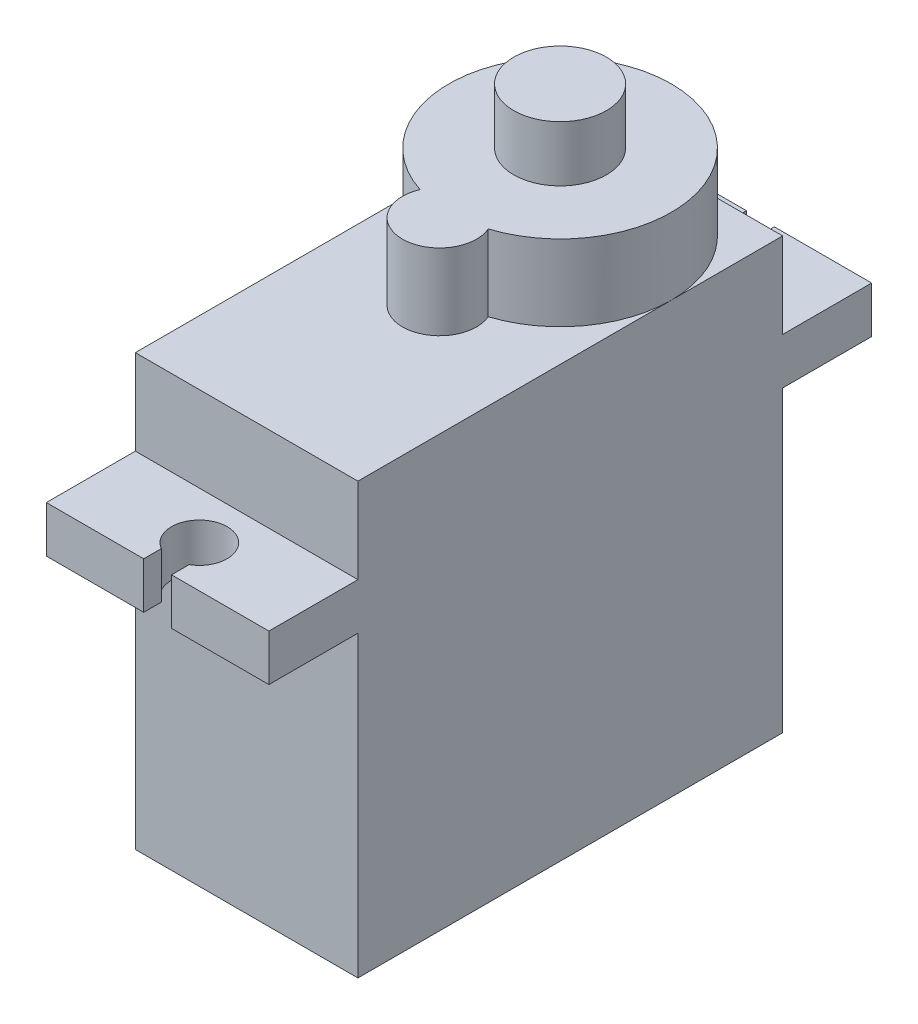
from build123d import *

# Parameters (mm, degrees)
SKETCH_1_W          = 12
SKETCH_1_H          = 22.9
EXTRUDE_1_DEPTH     = 23.2
SKETCH_2_R          = 6
SKETCH_2_R_2        = 2
EXTRUDE_2_DEPTH     = 4.1
SKETCH_3_R          = 2.5
EXTRUDE_3_DEPTH     = 3
SKETCH_4_W          = 12
SKETCH_4_H          = 2.5
EXTRUDE_4_DEPTH     = 4.8
CUT_EXTRUDE_1_REACH = 33.849
SKETCH_6_W          = 2
SKETCH_6_H          = 3
EXTRUDE_5_DEPTH     = 3


with BuildPart() as part:
    # 草图1 → 凸台-拉伸1 (new body)
    with BuildSketch(Plane(origin=(0, 0, 0), x_dir=(1, 0, 0), z_dir=(0, 1, 0))):
        with Locations((6, 11.45)):
            Rectangle(SKETCH_1_W, SKETCH_1_H)
    extrude(amount=EXTRUDE_1_DEPTH)

    # 草图2 → 凸台-拉伸2 (add)
    with BuildSketch(Plane(origin=(0, 23.2, 0), x_dir=(1, 0, 0), z_dir=(0, 1, 0))):
        with Locations((6, 16.9)):
            Circle(SKETCH_2_R)
        with Locations((6, 10.4)):
            Circle(SKETCH_2_R_2)
    extrude(amount=EXTRUDE_2_DEPTH)

    # 草图3 → 凸台-拉伸3 (add)
    with BuildSketch(Plane(origin=(0, 27.3, 0), x_dir=(1, 0, 0), z_dir=(0, 1, 0))):
        with Locations(Location((6, 16.9, 0), (0, 0, 270))):
            Circle(SKETCH_3_R)
    extrude(amount=EXTRUDE_3_DEPTH)

    # 草图4 → 凸台-拉伸4 (add)
    with BuildSketch(Plane.XY):
        with Locations((6, 17.35)):
            Rectangle(SKETCH_4_W, SKETCH_4_H)
    extrude_4 = extrude(amount=EXTRUDE_4_DEPTH)

    # 草图5 → 切除-拉伸1 (cut, up to next)
    with BuildSketch(Plane(origin=(0, 18.6, 0), x_dir=(1, 0, 0), z_dir=(0, 1, 0)), mode=Mode.PRIVATE) as cut_extrude_1_sk1:
        with BuildLine():
            Line((5.25, -4.8), (6.75, -4.8))
            Line((6.75, -4.8), (6.75, -3.849038106))
            ThreePointArc((6.75, -3.849038106), (6, -1.05), (5.25, -3.849038106))
            Line((5.25, -3.849038106), (5.25, -4.8))
        make_face()
    cut_extrude_1_tool1 = extrude(cut_extrude_1_sk1.sketch, amount=-CUT_EXTRUDE_1_REACH, mode=Mode.PRIVATE) & part.part
    cut_extrude_1 = cut_extrude_1_tool1.solids().sort_by_distance((6, 18.6, 2.821372))[0]
    add(cut_extrude_1, mode=Mode.SUBTRACT)

    # 镜向1: 凸台-拉伸4, 切除-拉伸1 across plane
    add(extrude_4.mirror(Plane.XY.offset(-11.45)))
    add(cut_extrude_1.mirror(Plane.XY.offset(-11.45)), mode=Mode.SUBTRACT)

    # 草图6 → 凸台-拉伸5 (add)
    with BuildSketch(Plane(origin=(0, 0, -22.9), x_dir=(-1, 0, 0), z_dir=(0, 0, -1))):
        with Locations((-7, 1.5)):
            Rectangle(SKETCH_6_W, SKETCH_6_H)
        with Locations((-5, 1.5)):
            Rectangle(SKETCH_6_W, SKETCH_6_H)
    extrude(amount=EXTRUDE_5_DEPTH)


solid = part.part
